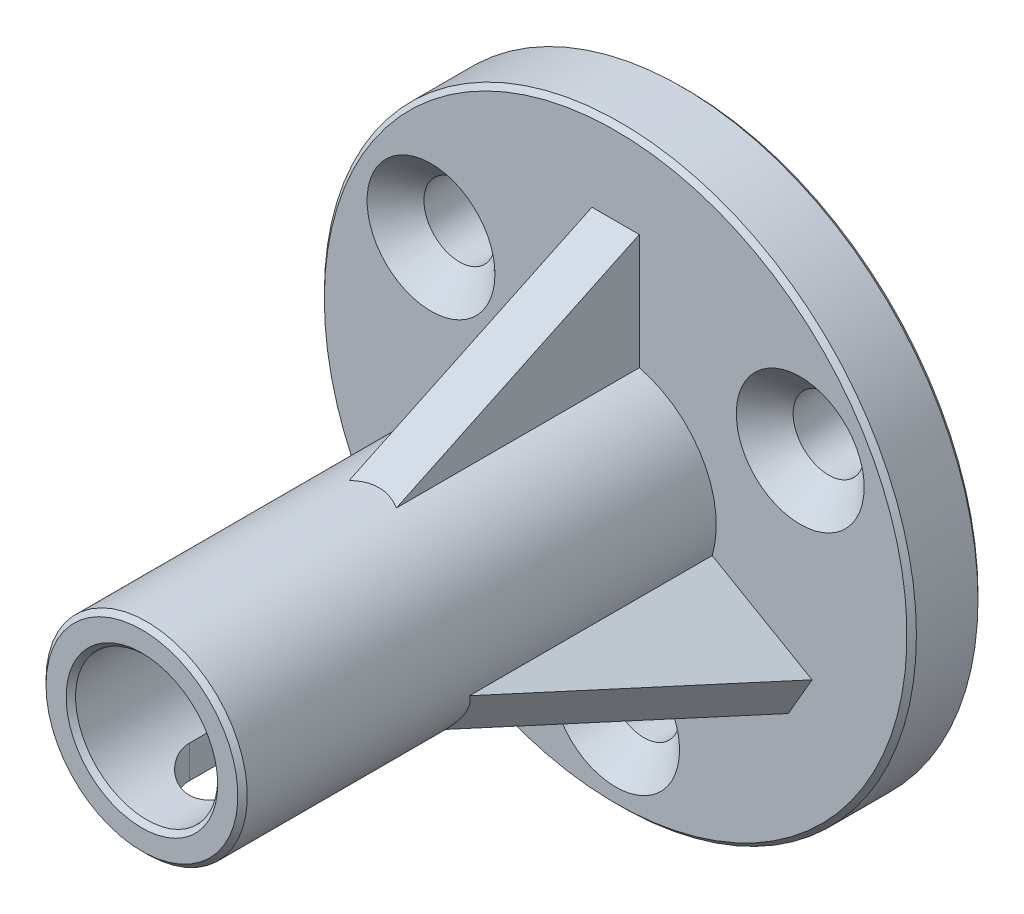
from build123d import *

# Parameters (mm, degrees)
SKETCH1_R               = 12.5
BOSS_EXTRUDE1_DEPTH     = 3
SKETCH2_R               = 4.25
SKETCH2_R_2             = 3
BOSS_EXTRUDE2_DEPTH     = 20
CUT_EXTRUDE2_REACH      = 28.693
SKETCH7_R               = 1.5
CHAMFER3_SIZE           = 1.2
CUT_EXTRUDE4_REACH      = 33.078
CUT_EXTRUDE4_END_RADIUS = 3
CUT_EXTRUDE5_REACH      = 28.693
SKETCH10_R              = 3
RIB3_REACH              = 31.009
SKETCH13_WALL_W         = 71.088033888
SKETCH13_WALL_H         = 2
CIRPATTERN3_COUNT       = 3
CHAMFER8_SIZE           = 0.2


with BuildPart() as part:
    # Sketch1 → Boss-Extrude1 (new body)
    with BuildSketch(Plane.XY):
        Circle(SKETCH1_R)
    extrude(amount=BOSS_EXTRUDE1_DEPTH)

    # Sketch2 → Boss-Extrude2 (add)
    with BuildSketch(Plane.XY.offset(3)):
        Circle(SKETCH2_R)
        Circle(SKETCH2_R_2, mode=Mode.SUBTRACT)
    extrude(amount=BOSS_EXTRUDE2_DEPTH)

    # Sketch7 → Cut-Extrude2 (cut, up to next)
    with BuildSketch(Plane.XY.offset(3), mode=Mode.PRIVATE) as cut_extrude2_sk1:
        with Locations((7.794228634, 4.5)):
            Circle(SKETCH7_R)
    cut_extrude2_tool1 = extrude(cut_extrude2_sk1.sketch, amount=-CUT_EXTRUDE2_REACH, mode=Mode.PRIVATE) & part.part
    # Sketch7 → Cut-Extrude2 (cut, up to next)
    with BuildSketch(Plane.XY.offset(3), mode=Mode.PRIVATE) as cut_extrude2_sk2:
        with Locations((0, -9)):
            Circle(SKETCH7_R)
    cut_extrude2_tool2 = extrude(cut_extrude2_sk2.sketch, amount=-CUT_EXTRUDE2_REACH, mode=Mode.PRIVATE) & part.part
    # Sketch7 → Cut-Extrude2 (cut, up to next)
    with BuildSketch(Plane.XY.offset(3), mode=Mode.PRIVATE) as cut_extrude2_sk3:
        with Locations((-7.794228634, 4.5)):
            Circle(SKETCH7_R)
    cut_extrude2_tool3 = extrude(cut_extrude2_sk3.sketch, amount=-CUT_EXTRUDE2_REACH, mode=Mode.PRIVATE) & part.part
    add(cut_extrude2_tool1.solids().sort_by_distance((7.794229, 4.5, 3))[0], mode=Mode.SUBTRACT)
    add(cut_extrude2_tool2.solids().sort_by_distance((0, -9, 3))[0], mode=Mode.SUBTRACT)
    add(cut_extrude2_tool3.solids().sort_by_distance((-7.794229, 4.5, 3))[0], mode=Mode.SUBTRACT)

    # Chamfer3
    chamfer3_edges = [part.edges().sort_by_distance(p)[0] for p in [
        (6.294228634, 4.5, 3),
        (-1.5, -9, 3),
        (-9.294228634, 4.5, 3),
    ]]
    chamfer(chamfer3_edges, length=CHAMFER3_SIZE)

    # Cut-Extrude4: up to this cylinder (the profile starts outside it)
    cut_extrude4_end = Plane(origin=(0, 0, 16.5), z_dir=(0, 0, -1)) * Cylinder(CUT_EXTRUDE4_END_RADIUS, 73.156, mode=Mode.PRIVATE)
    # Sketch9 → Cut-Extrude4 (cut, up to the surface)
    with BuildSketch(Plane(origin=(0, -4.25, 0), x_dir=(1, 0, 0), z_dir=(0, 1, 0)), mode=Mode.PRIVATE) as cut_extrude4_sk1:
        with BuildLine():
            Line((-1.5, -13.5), (-1.5, -19.5))
            ThreePointArc((-1.5, -19.5), (0, -21), (1.5, -19.5))
            Line((1.5, -19.5), (1.5, -13.5))
            ThreePointArc((1.5, -13.5), (0, -12), (-1.5, -13.5))
        make_face()
    cut_extrude4_tool1 = extrude(cut_extrude4_sk1.sketch, amount=CUT_EXTRUDE4_REACH, mode=Mode.PRIVATE) - cut_extrude4_end
    add(cut_extrude4_tool1.solids().sort_by_distance((0, -4.25, 16.5))[0], mode=Mode.SUBTRACT)

    # Sketch10 → Cut-Extrude5 (cut, up to next)
    with BuildSketch(Plane.XY.offset(3), mode=Mode.PRIVATE) as cut_extrude5_sk1:
        Circle(SKETCH10_R)
    cut_extrude5_tool1 = extrude(cut_extrude5_sk1.sketch, amount=-CUT_EXTRUDE5_REACH, mode=Mode.PRIVATE) & part.part
    add(cut_extrude5_tool1.solids().sort_by_distance((0, 0, 3))[0], mode=Mode.SUBTRACT)

    # Sketch13 wall → Rib3 (add, up to next)
    with BuildSketch(Plane(origin=(0, 6.625, 8), x_dir=(0, -0.429056814568, 0.903277504354), z_dir=(0, -0.903277504354, -0.429056814568)), mode=Mode.PRIVATE) as rib3_sk1:
        Rectangle(SKETCH13_WALL_W, SKETCH13_WALL_H)
    rib3_tool1 = extrude(rib3_sk1.sketch, amount=RIB3_REACH, mode=Mode.PRIVATE) - part.part
    rib3 = rib3_tool1.solids().sort_by_distance((0, 6.625, 8))[0]
    add(rib3)

    # CirPattern3: Rib3 ×3 about axis
    cirpattern3_axis = Axis((0, 0, 0), (0, 0, 1))
    for i in range(1, CIRPATTERN3_COUNT):
        add(rib3.rotate(cirpattern3_axis, i * 360 / CIRPATTERN3_COUNT))

    # Chamfer8
    chamfer8_edges = [part.edges().sort_by_distance(p)[0] for p in [
        (-12.5, 0, 0),
        (-12.5, 0, 3),
        (-4.25, 0, 23),
        (-3, 0, 23),
    ]]
    chamfer(chamfer8_edges, length=CHAMFER8_SIZE)


solid = part.part
